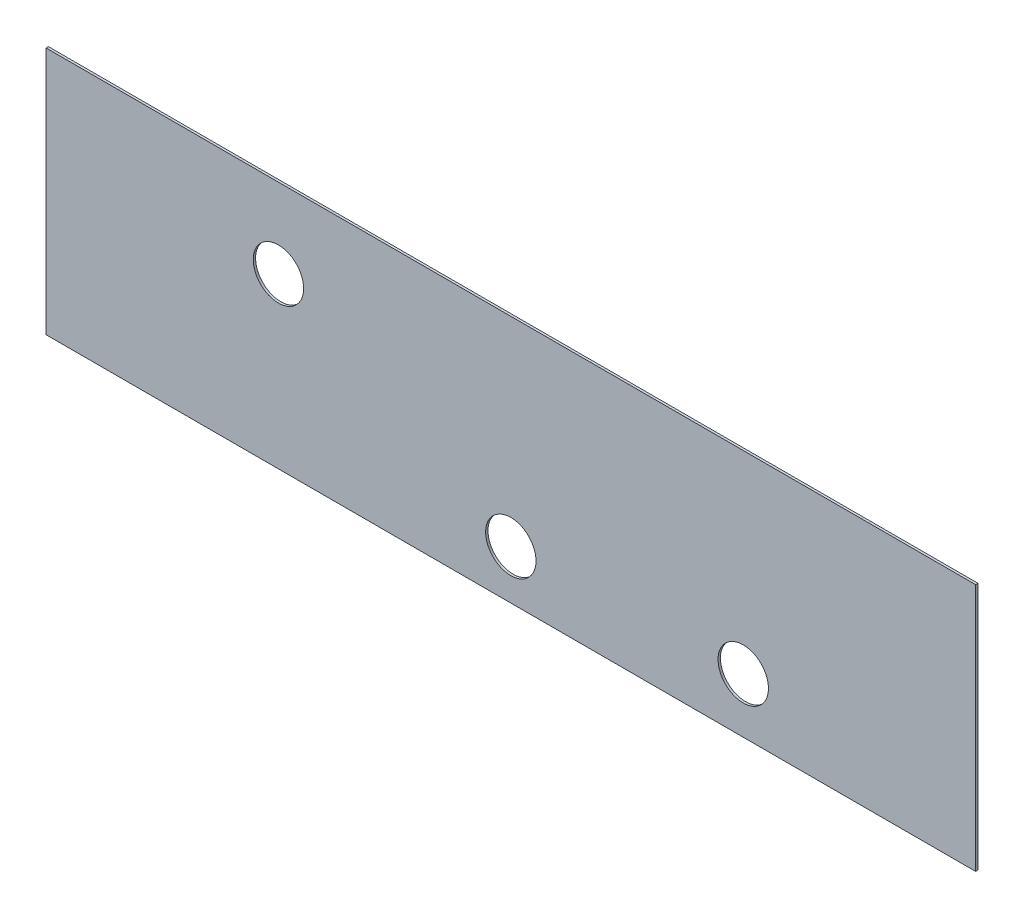
from build123d import *

# Parameters (mm, degrees)
SKETCH1_W           = 394.92
SKETCH1_H           = 105.5
SKETCH1_R           = 10.7
BOSS_EXTRUDE1_DEPTH = 1


with BuildPart() as part:
    # Sketch1 → Boss-Extrude1 (new body)
    with BuildSketch(Plane.XY):
        with Locations((197.46, 52.75)):
            Rectangle(SKETCH1_W, SKETCH1_H)
        with Locations((197.46, 20.8)):
            Circle(SKETCH1_R, mode=Mode.SUBTRACT)
        with Locations((98.73, 71.7)):
            Circle(SKETCH1_R, mode=Mode.SUBTRACT)
        with Locations((296.19, 23.3)):
            Circle(SKETCH1_R, mode=Mode.SUBTRACT)
    extrude(amount=BOSS_EXTRUDE1_DEPTH)


solid = part.part
